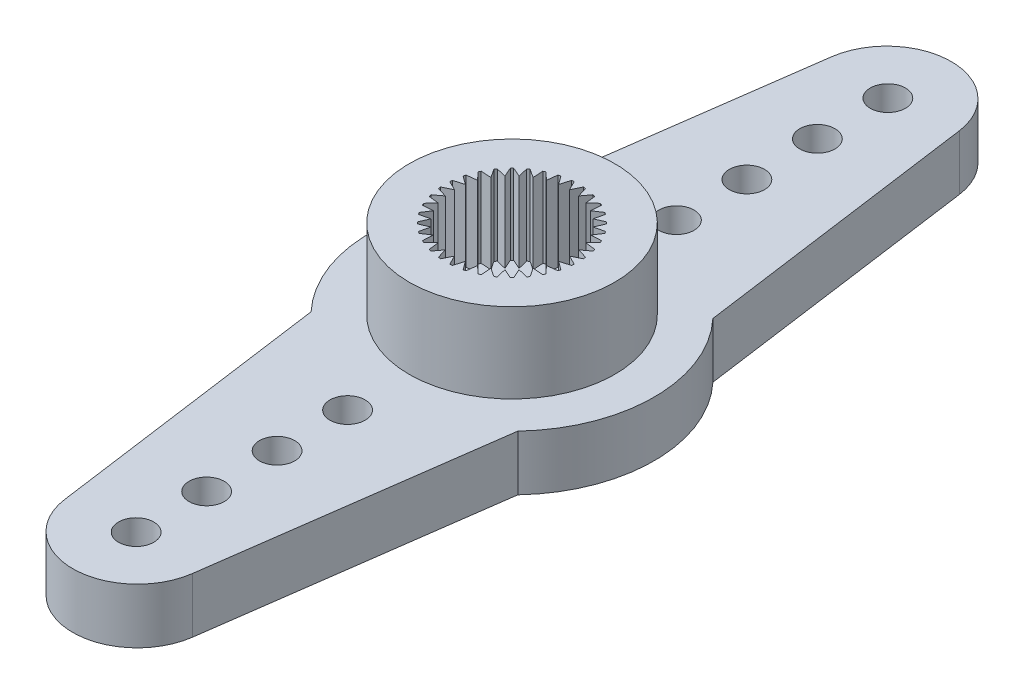
from build123d import *

# Parameters (mm, degrees)
BOSS_EXTRUDE1_DEPTH  = 2.35
SKETCH2_R            = 4.375
BOSS_EXTRUDE2_DEPTH  = 3.4
CUT_EXTRUDE1_DEPTH   = 3.4
HOLEWZD1_D           = 8.8
HOLEWZD1_DEPTH       = 0.3
SKETCH6_W            = 3.25
SKETCH6_H            = 0.3
HOLEWZD2_D           = 1.5
HOLEWZD3_D           = 3
HOLEWZD3_DEPTH       = 5.75
HOLEWZD3_CBORE_D     = 5.5
HOLEWZD3_CBORE_DEPTH = 0.3


with BuildPart() as part:
    # Sketch1 → Boss-Extrude1 (new body)
    with BuildSketch(Plane(origin=(0, 2.35, 0), x_dir=(1, 0, 0), z_dir=(0, 1, 0))):
        with BuildLine():
            Line((2.724307673, -16.32503027), (4.4, -4.152408939))
            ThreePointArc((4.4, -4.152408939), (6.05, 0), (4.4, 4.152408939))
            Line((4.4, 4.152408939), (2.724307673, 16.32503027))
            ThreePointArc((2.724307673, 16.32503027), (0, 18.7), (-2.724307673, 16.32503027))
            Line((-2.724307673, 16.32503027), (-4.4, 4.152408939))
            ThreePointArc((-4.4, 4.152408939), (-6.05, 0), (-4.4, -4.152408939))
            Line((-4.4, -4.152408939), (-2.724307673, -16.32503027))
            ThreePointArc((-2.724307673, -16.32503027), (0, -18.7), (2.724307673, -16.32503027))
        make_face()
    extrude(amount=-BOSS_EXTRUDE1_DEPTH)

    # Sketch2 → Boss-Extrude2 (add)
    with BuildSketch(Plane(origin=(0, 2.35, 0), x_dir=(-1, 0, 0), z_dir=(0, 1, 0))):
        with Locations(Location((0, 0, 0), (0, 0, 90))):
            Circle(SKETCH2_R)
    extrude(amount=BOSS_EXTRUDE2_DEPTH)

    # Sketch3 → Cut-Extrude1 (cut)
    with BuildSketch(Plane(origin=(0, 5.75, 0), x_dir=(-1, 0, 0), z_dir=(0, 1, 0))):
        with BuildLine():
            Line((0.687336745, 2.765875666), (0.425438035, 2.412778995))
            Line((0.425438035, 2.412778995), (0.300099924, 2.834155965))
            ThreePointArc((0.300099924, 2.834155965), (0.248393867, 2.83915489), (0.196605286, 2.843210573))
            Line((0.196605286, 2.843210573), (0, 2.45))
            Line((0, 2.45), (-0.196605286, 2.843210573))
            ThreePointArc((-0.196605286, 2.843210573), (-0.248393867, 2.83915489), (-0.300099924, 2.834155965))
            Line((-0.300099924, 2.834155965), (-0.425438035, 2.412778995))
            Line((-0.425438035, 2.412778995), (-0.687336745, 2.765875666))
            ThreePointArc((-0.687336745, 2.765875666), (-0.737634279, 2.752888605), (-0.787686751, 2.738986963))
            Line((-0.787686751, 2.738986963), (-0.837949351, 2.302246921))
            Line((-0.837949351, 2.302246921), (-1.157183824, 2.604501026))
            ThreePointArc((-1.157183824, 2.604501026), (-1.204462046, 2.582977193), (-1.251340114, 2.560595228))
            Line((-1.251340114, 2.560595228), (-1.225, 2.121762239))
            Line((-1.225, 2.121762239), (-1.591870459, 2.363989941))
            ThreePointArc((-1.591870459, 2.363989941), (-1.634692844, 2.334583326), (-1.676972141, 2.304401102))
            Line((-1.676972141, 2.304401102), (-1.574829644, 1.876808886))
            Line((-1.574829644, 1.876808886), (-1.978188915, 2.051650218))
            ThreePointArc((-1.978188915, 2.051650218), (-2.015254326, 2.015254326), (-2.051650218, 1.978188915))
            Line((-2.051650218, 1.978188915), (-1.876808886, 1.574829644))
            Line((-1.876808886, 1.574829644), (-2.304401102, 1.676972141))
            ThreePointArc((-2.304401102, 1.676972141), (-2.334583326, 1.634692844), (-2.363989941, 1.591870459))
            Line((-2.363989941, 1.591870459), (-2.121762239, 1.225))
            Line((-2.121762239, 1.225), (-2.560595228, 1.251340114))
            ThreePointArc((-2.560595228, 1.251340114), (-2.582977193, 1.204462046), (-2.604501026, 1.157183824))
            Line((-2.604501026, 1.157183824), (-2.302246921, 0.837949351))
            Line((-2.302246921, 0.837949351), (-2.738986963, 0.787686751))
            ThreePointArc((-2.738986963, 0.787686751), (-2.752888605, 0.737634279), (-2.765875666, 0.687336745))
            Line((-2.765875666, 0.687336745), (-2.412778995, 0.425438035))
            Line((-2.412778995, 0.425438035), (-2.834155965, 0.300099924))
            ThreePointArc((-2.834155965, 0.300099924), (-2.83915489, 0.248393867), (-2.843210573, 0.196605286))
            Line((-2.843210573, 0.196605286), (-2.45, 0))
            Line((-2.45, 0), (-2.843210573, -0.196605286))
            ThreePointArc((-2.843210573, -0.196605286), (-2.83915489, -0.248393867), (-2.834155965, -0.300099924))
            Line((-2.834155965, -0.300099924), (-2.412778995, -0.425438035))
            Line((-2.412778995, -0.425438035), (-2.765875666, -0.687336745))
            ThreePointArc((-2.765875666, -0.687336745), (-2.752888605, -0.737634279), (-2.738986963, -0.787686751))
            Line((-2.738986963, -0.787686751), (-2.302246921, -0.837949351))
            Line((-2.302246921, -0.837949351), (-2.604501026, -1.157183824))
            ThreePointArc((-2.604501026, -1.157183824), (-2.582977193, -1.204462046), (-2.560595228, -1.251340114))
            Line((-2.560595228, -1.251340114), (-2.121762239, -1.225))
            Line((-2.121762239, -1.225), (-2.363989941, -1.591870459))
            ThreePointArc((-2.363989941, -1.591870459), (-2.334583326, -1.634692844), (-2.304401102, -1.676972141))
            Line((-2.304401102, -1.676972141), (-1.876808886, -1.574829644))
            Line((-1.876808886, -1.574829644), (-2.051650218, -1.978188915))
            ThreePointArc((-2.051650218, -1.978188915), (-2.015254326, -2.015254326), (-1.978188915, -2.051650218))
            Line((-1.978188915, -2.051650218), (-1.574829644, -1.876808886))
            Line((-1.574829644, -1.876808886), (-1.676972141, -2.304401102))
            ThreePointArc((-1.676972141, -2.304401102), (-1.634692844, -2.334583326), (-1.591870459, -2.363989941))
            Line((-1.591870459, -2.363989941), (-1.225, -2.121762239))
            Line((-1.225, -2.121762239), (-1.251340114, -2.560595228))
            ThreePointArc((-1.251340114, -2.560595228), (-1.204462046, -2.582977193), (-1.157183824, -2.604501026))
            Line((-1.157183824, -2.604501026), (-0.837949351, -2.302246921))
            Line((-0.837949351, -2.302246921), (-0.787686751, -2.738986963))
            ThreePointArc((-0.787686751, -2.738986963), (-0.737634279, -2.752888605), (-0.687336745, -2.765875666))
            Line((-0.687336745, -2.765875666), (-0.425438035, -2.412778995))
            Line((-0.425438035, -2.412778995), (-0.300099924, -2.834155965))
            ThreePointArc((-0.300099924, -2.834155965), (-0.248393867, -2.83915489), (-0.196605286, -2.843210573))
            Line((-0.196605286, -2.843210573), (0, -2.45))
            Line((0, -2.45), (0.196605286, -2.843210573))
            ThreePointArc((0.196605286, -2.843210573), (0.248393867, -2.83915489), (0.300099924, -2.834155965))
            Line((0.300099924, -2.834155965), (0.425438035, -2.412778995))
            Line((0.425438035, -2.412778995), (0.687336745, -2.765875666))
            ThreePointArc((0.687336745, -2.765875666), (0.737634279, -2.752888605), (0.787686751, -2.738986963))
            Line((0.787686751, -2.738986963), (0.837949351, -2.302246921))
            Line((0.837949351, -2.302246921), (1.157183824, -2.604501026))
            ThreePointArc((1.157183824, -2.604501026), (1.204462046, -2.582977193), (1.251340114, -2.560595228))
            Line((1.251340114, -2.560595228), (1.225, -2.121762239))
            Line((1.225, -2.121762239), (1.591870459, -2.363989941))
            ThreePointArc((1.591870459, -2.363989941), (1.634692844, -2.334583326), (1.676972141, -2.304401102))
            Line((1.676972141, -2.304401102), (1.574829644, -1.876808886))
            Line((1.574829644, -1.876808886), (1.978188915, -2.051650218))
            ThreePointArc((1.978188915, -2.051650218), (2.015254326, -2.015254326), (2.051650218, -1.978188915))
            Line((2.051650218, -1.978188915), (1.876808886, -1.574829644))
            Line((1.876808886, -1.574829644), (2.304401102, -1.676972141))
            ThreePointArc((2.304401102, -1.676972141), (2.334583326, -1.634692844), (2.363989941, -1.591870459))
            Line((2.363989941, -1.591870459), (2.121762239, -1.225))
            Line((2.121762239, -1.225), (2.560595228, -1.251340114))
            ThreePointArc((2.560595228, -1.251340114), (2.582977193, -1.204462046), (2.604501026, -1.157183824))
            Line((2.604501026, -1.157183824), (2.302246921, -0.837949351))
            Line((2.302246921, -0.837949351), (2.738986963, -0.787686751))
            ThreePointArc((2.738986963, -0.787686751), (2.752888605, -0.737634279), (2.765875666, -0.687336745))
            Line((2.765875666, -0.687336745), (2.412778995, -0.425438035))
            Line((2.412778995, -0.425438035), (2.834155965, -0.300099924))
            ThreePointArc((2.834155965, -0.300099924), (2.83915489, -0.248393867), (2.843210573, -0.196605286))
            Line((2.843210573, -0.196605286), (2.45, 0))
            Line((2.45, 0), (2.843210573, 0.196605286))
            ThreePointArc((2.843210573, 0.196605286), (2.83915489, 0.248393867), (2.834155965, 0.300099924))
            Line((2.834155965, 0.300099924), (2.412778995, 0.425438035))
            Line((2.412778995, 0.425438035), (2.765875666, 0.687336745))
            ThreePointArc((2.765875666, 0.687336745), (2.752888605, 0.737634279), (2.738986963, 0.787686751))
            Line((2.738986963, 0.787686751), (2.302246921, 0.837949351))
            Line((2.302246921, 0.837949351), (2.604501026, 1.157183824))
            ThreePointArc((2.604501026, 1.157183824), (2.582977193, 1.204462046), (2.560595228, 1.251340114))
            Line((2.560595228, 1.251340114), (2.121762239, 1.225))
            Line((2.121762239, 1.225), (2.363989941, 1.591870459))
            ThreePointArc((2.363989941, 1.591870459), (2.334583326, 1.634692844), (2.304401102, 1.676972141))
            Line((2.304401102, 1.676972141), (1.876808886, 1.574829644))
            Line((1.876808886, 1.574829644), (2.051650218, 1.978188915))
            ThreePointArc((2.051650218, 1.978188915), (2.015254326, 2.015254326), (1.978188915, 2.051650218))
            Line((1.978188915, 2.051650218), (1.574829644, 1.876808886))
            Line((1.574829644, 1.876808886), (1.676972141, 2.304401102))
            ThreePointArc((1.676972141, 2.304401102), (1.634692844, 2.334583326), (1.591870459, 2.363989941))
            Line((1.591870459, 2.363989941), (1.225, 2.121762239))
            Line((1.225, 2.121762239), (1.251340114, 2.560595228))
            ThreePointArc((1.251340114, 2.560595228), (1.204462046, 2.582977193), (1.157183824, 2.604501026))
            Line((1.157183824, 2.604501026), (0.837949351, 2.302246921))
            Line((0.837949351, 2.302246921), (0.787686751, 2.738986963))
            ThreePointArc((0.787686751, 2.738986963), (0.737634279, 2.752888605), (0.687336745, 2.765875666))
        make_face()
    extrude(amount=-CUT_EXTRUDE1_DEPTH, mode=Mode.SUBTRACT)

    # HoleWzd1
    with Locations(Plane(origin=(0, 0, 0), x_dir=(-1, 0, 0), z_dir=(0, -1, 0))):
        with Locations((0, 0)):
            Hole(HOLEWZD1_D / 2, depth=HOLEWZD1_DEPTH)

    # Sketch6 → Revolve1 (revolve)
    with BuildSketch(Plane.XY, mode=Mode.PRIVATE) as revolve1_sk:
        with Locations((1.625, 0.15)):
            Rectangle(SKETCH6_W, SKETCH6_H)
    revolve(revolve1_sk.sketch.rotate(Axis((0, 0.3, 0), (0, -1, 0)), 270), axis=Axis((0, 0.3, 0), (0, -1, 0)))

    # HoleWzd2 (through all)
    with Locations(Plane(origin=(0, 2.35, 0), x_dir=(1, 0, 0), z_dir=(0, 1, 0))):
        with Locations((0, -7), (0, 16), (0, -10), (0, -13), (0, -16), (0, 13), (0, 10), (0, 7)):
            Hole(HOLEWZD2_D / 2)

    # HoleWzd3
    with Locations(Plane(origin=(0, 0, 0), x_dir=(-1, 0, 0), z_dir=(0, -1, 0))):
        with Locations((0, 0)):
            CounterBoreHole(HOLEWZD3_D / 2, HOLEWZD3_CBORE_D / 2, HOLEWZD3_CBORE_DEPTH, depth=HOLEWZD3_DEPTH)


solid = part.part
